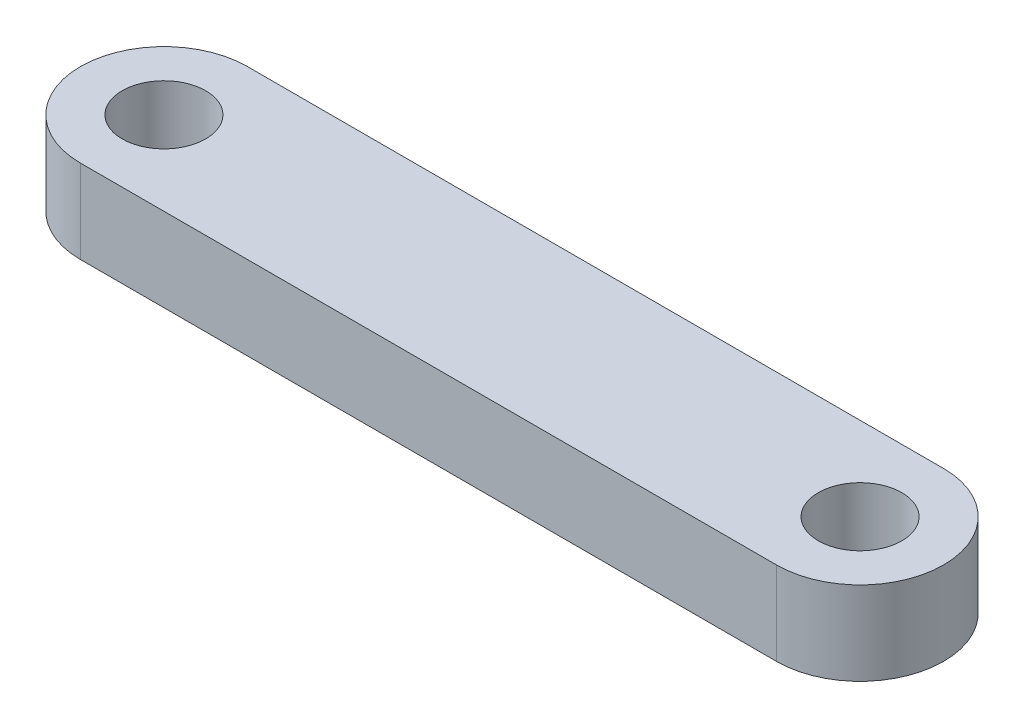
from build123d import *

# Parameters (mm, degrees)
SKETCH3_R           = 1.5
BOSS_EXTRUDE1_DEPTH = 3


with BuildPart() as part:
    # Sketch3 → Boss-Extrude1 (new body)
    with BuildSketch(Plane(origin=(0, 0, 0), x_dir=(1, 0, 0), z_dir=(0, 1, 0))):
        with BuildLine():
            Line((0, 15.5), (25, 15.5))
            ThreePointArc((25, 15.5), (28, 12.5), (25, 9.5))
            Line((25, 9.5), (0, 9.5))
            ThreePointArc((0, 9.5), (-3, 12.5), (0, 15.5))
        make_face()
        with Locations(Location((25, 12.5, 0), (0, 0, 270))):
            Circle(SKETCH3_R, mode=Mode.SUBTRACT)
        with Locations(Location((0, 12.5, 0), (0, 0, 270))):
            Circle(SKETCH3_R, mode=Mode.SUBTRACT)
    extrude(amount=BOSS_EXTRUDE1_DEPTH)


solid = part.part
